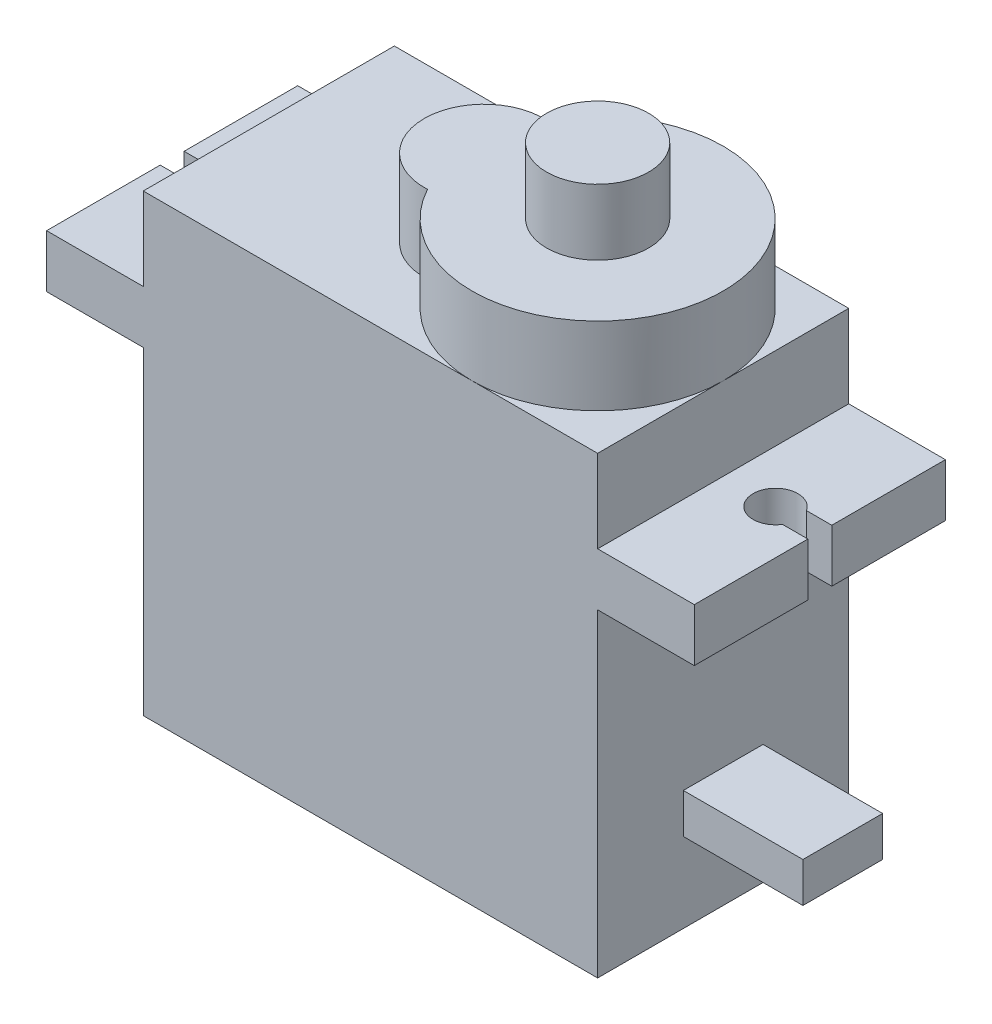
from build123d import *

# Parameters (mm, degrees)
BODY_DEPTH     = 6.3
HUB_BODY_DEPTH = 3.9
HUB_START      = -26.7
SKETCH3_R      = 2.56
HUB_DEPTH      = 30
HOLES_REACH    = 27.526
SKETCH5_W      = 4
SKETCH5_H      = 2
WIRES_2_DEPTH  = 6


with BuildPart() as part:
    # front body → body (new, symmetric)
    with BuildSketch(Plane.XY):
        Polygon((-11.4, 22.8), (11.4, 22.8), (11.4, 18.65), (16.25, 18.65), (16.25, 16), (11.4, 16), (11.4, 0), (-11.4, 0), (-11.4, 16), (-16.25, 16), (-16.25, 18.65), (-11.4, 18.65), align=None)
    extrude(amount=BODY_DEPTH, both=True)

    # Sketch2 → hub body (add)
    with BuildSketch(Plane(origin=(0, 22.8, 0), x_dir=(1, 0, 0), z_dir=(0, 1, 0))):
        with BuildLine():
            ThreePointArc((-0.442105263, -2.995841994), (11.4, 0), (-0.442105263, 2.995841994))
            ThreePointArc((-0.442105263, 2.995841994), (-3.6, 0), (-0.442105263, -2.995841994))
        make_face()
    extrude(amount=HUB_BODY_DEPTH)

    # Sketch3 → hub (add)
    with BuildSketch(Plane(origin=(0, 26.7, 0), x_dir=(1, 0, 0), z_dir=(0, 1, 0)).offset(HUB_START)):
        with Locations(Location((5.1, 0, 0), (0, 0, 270))):
            Circle(SKETCH3_R)
    extrude(amount=HUB_DEPTH)

    # mounting holes → holes (cut, up to next)
    with BuildSketch(Plane(origin=(0, 18.65, 0), x_dir=(1, 0, 0), z_dir=(0, 1, 0)), mode=Mode.PRIVATE) as holes_sk1:
        with BuildLine():
            Line((-14.976643316, 0.6), (-16.25, 0.6))
            Line((-16.25, 0.6), (-16.25, -0.6))
            Line((-16.25, -0.6), (-14.976643316, -0.6))
            ThreePointArc((-14.976643316, -0.6), (-12.9, 0), (-14.976643316, 0.6))
        make_face()
    holes_tool1 = extrude(holes_sk1.sketch, amount=-HOLES_REACH, mode=Mode.PRIVATE) & part.part
    # mounting holes → holes (cut, up to next)
    with BuildSketch(Plane(origin=(0, 18.65, 0), x_dir=(1, 0, 0), z_dir=(0, 1, 0)), mode=Mode.PRIVATE) as holes_sk2:
        with BuildLine():
            Line((16.25, 0.6), (16.25, -0.6))
            Line((16.25, -0.6), (14.976643316, -0.6))
            ThreePointArc((14.976643316, -0.6), (12.9, 0), (14.976643316, 0.6))
            Line((14.976643316, 0.6), (16.25, 0.6))
        make_face()
    holes_tool2 = extrude(holes_sk2.sketch, amount=-HOLES_REACH, mode=Mode.PRIVATE) & part.part
    add(holes_tool1.solids().sort_by_distance((-14.450684, 18.65, 0))[0], mode=Mode.SUBTRACT)
    add(holes_tool2.solids().sort_by_distance((14.450684, 18.65, 0))[0], mode=Mode.SUBTRACT)

    # Sketch5 → Wires 2 (add)
    with BuildSketch(Plane(origin=(11.4, 0, 0), x_dir=(0, 0, -1), z_dir=(1, 0, 0))):
        with Locations((0, 5)):
            Rectangle(SKETCH5_W, SKETCH5_H)
    extrude(amount=WIRES_2_DEPTH)


solid = part.part
